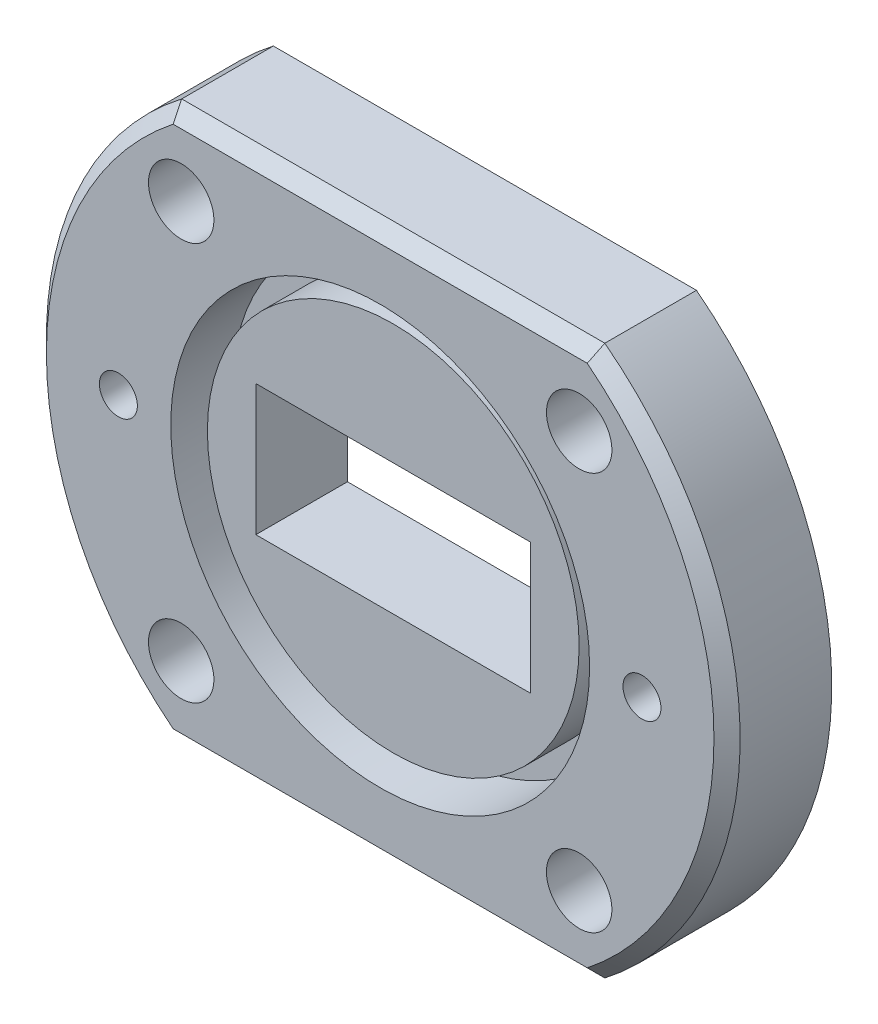
from build123d import *

# Parameters (mm, degrees)
SKETCH_1_R               = 26.5
EXTRUDE_1_DEPTH          = 8
SKETCH_2_R               = 16
CUT_EXTRUDE_1_DEPTH      = 1
SKETCH_3_R               = 16
SKETCH_3_R_2             = 14.2
CUT_EXTRUDE_2_DEPTH      = 3.7
SKETCH_4_W               = 21
SKETCH_4_H               = 10
CUT_EXTRUDE_3_DEPTH      = 39.124795081
SKETCH_5_R               = 2.5
CUT_EXTRUDE_4_DEPTH      = 39.321012513
PATTERN_CIRCULAR_1_COUNT = 4
CHAMFER_1_SIZE           = 1
SKETCH_6_W               = 30
SKETCH_6_H               = 30
M3_5X0_61_D              = 2.9
CHAMFER_2_SIZE           = 1


with BuildPart() as part:
    # Эскиз1 → Бобышка-Вытянуть1 (new body)
    with BuildSketch(Plane.XY):
        Circle(SKETCH_1_R)
    extrude(amount=EXTRUDE_1_DEPTH)

    # Эскиз2 → Вырез-Вытянуть1 (cut)
    with BuildSketch(Plane.XY.offset(8)):
        Circle(SKETCH_2_R)
    extrude(amount=-CUT_EXTRUDE_1_DEPTH, mode=Mode.SUBTRACT)

    # Эскиз3 → Вырез-Вытянуть2 (cut)
    with BuildSketch(Plane.XY.offset(7)):
        Circle(SKETCH_3_R)
        Circle(SKETCH_3_R_2, mode=Mode.SUBTRACT)
    extrude(amount=-CUT_EXTRUDE_2_DEPTH, mode=Mode.SUBTRACT)

    # Эскиз4 → Вырез-Вытянуть3 (cut, through all)
    with BuildSketch(Plane.XY.offset(7)):
        Rectangle(SKETCH_4_W, SKETCH_4_H)
    extrude(amount=-CUT_EXTRUDE_3_DEPTH, mode=Mode.SUBTRACT)

    # Эскиз5 → Вырез-Вытянуть4 (cut, through all)
    with BuildSketch(Plane.XY.offset(8)):
        with Locations((-15.202795796, 15.202795796)):
            Circle(SKETCH_5_R)
    cut_extrude_4 = extrude(amount=-CUT_EXTRUDE_4_DEPTH, mode=Mode.SUBTRACT)

    # Круговой массив1: Вырез-Вытянуть4 ×4 about axis
    pattern_circular_1_axis = Axis((0, 0, 0), (0, 0, 1))
    for i in range(1, PATTERN_CIRCULAR_1_COUNT):
        add(cut_extrude_4.rotate(pattern_circular_1_axis, i * 360 / PATTERN_CIRCULAR_1_COUNT), mode=Mode.SUBTRACT)

    # Фаска1
    chamfer_1_edges = [part.edges().sort_by_distance(p)[0] for p in [
        (-26.5, 0, 8),
    ]]
    chamfer(chamfer_1_edges, length=CHAMFER_1_SIZE)

    # Эскиз6 → Вырез-Повернуть1 (revolve, cut)
    with BuildSketch(Plane.XY):
        with Locations((15, 36)):
            Rectangle(SKETCH_6_W, SKETCH_6_H)
    cut_revolve_1 = revolve(axis=Axis((0, 0, 0), (0, 1, 0)), mode=Mode.SUBTRACT)

    # Зеркальное отражение1: Вырез-Повернуть1 across plane
    add(cut_revolve_1.mirror(Plane.ZX), mode=Mode.SUBTRACT)

    # Отверстие обработанное метчиком M3.5x0.61 (through all)
    with Locations(Plane(origin=(-20, 0, 8), x_dir=(1, 0, 0), z_dir=(0, 0, 1))):
        with Locations((0, 0)):
            m3_5x0_61 = Hole(M3_5X0_61_D / 2)

    # Зеркальное отражение2: Отверстие обработанное метчиком M3.5x0.61 across plane
    add(m3_5x0_61.mirror(Plane(origin=(0, 0, 0), x_dir=(0, 0, 1), z_dir=(1, 0, 0))), mode=Mode.SUBTRACT)

    # Фаска2
    chamfer_2_edges = [part.edges().sort_by_distance(p)[0] for p in [
        (0, -21, 8),
        (0, 21, 8),
    ]]
    chamfer(chamfer_2_edges, length=CHAMFER_2_SIZE)


solid = part.part
